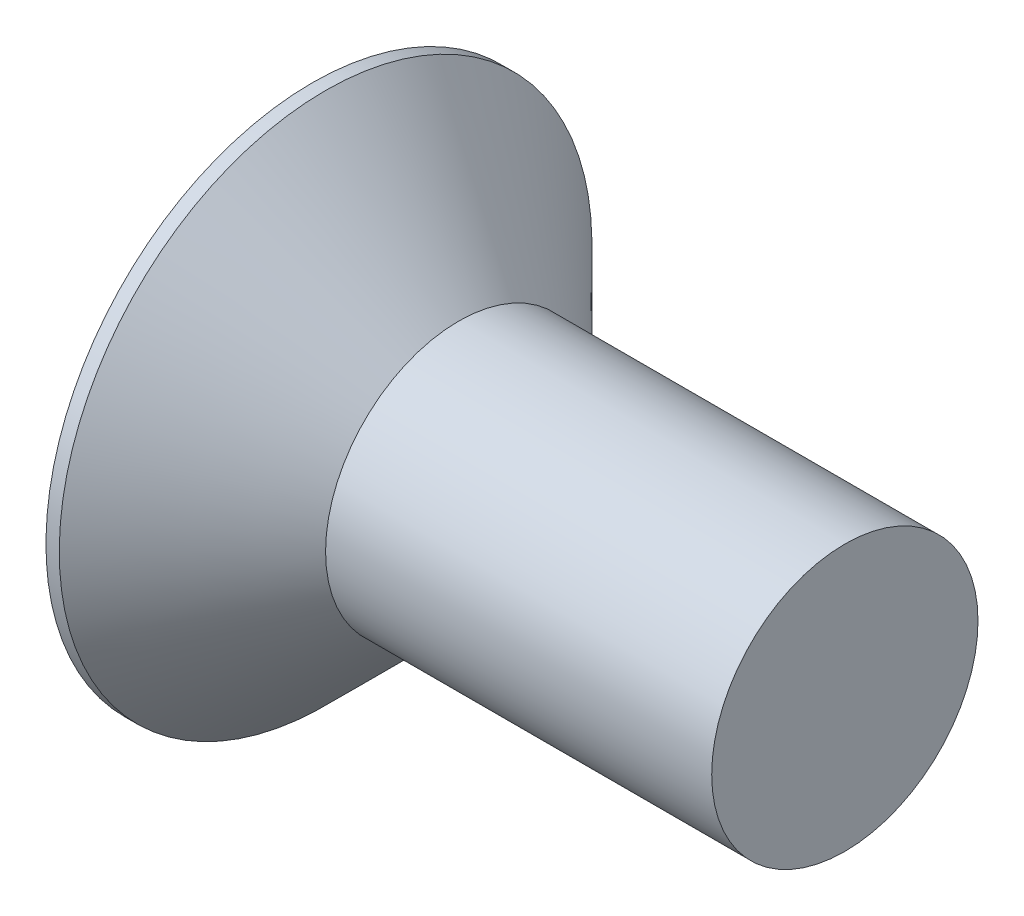
from build123d import *

# Parameters (mm, degrees)
CUT_EXTRUDE1_DEPTH = 2


with BuildPart() as part:
    # Sketch1 → Revolve1 (revolve)
    with BuildSketch(Plane.XY):
        Polygon((0, 0), (0, 6), (0.3, 6), (3.3, 3), (12, 3), (12, 0), align=None)
    revolve(axis=Axis((12, 0, 0), (-1, 0, 0)))

    # Sketch2 → Cut-Extrude1 (cut)
    with BuildSketch(Plane.ZY):
        Polygon((1.154700538, 2), (-1.154700538, 2), (-2.309401077, 0), (-1.154700538, -2), (1.154700538, -2), (2.309401077, 0), align=None)
    extrude(amount=-CUT_EXTRUDE1_DEPTH, mode=Mode.SUBTRACT)


solid = part.part
